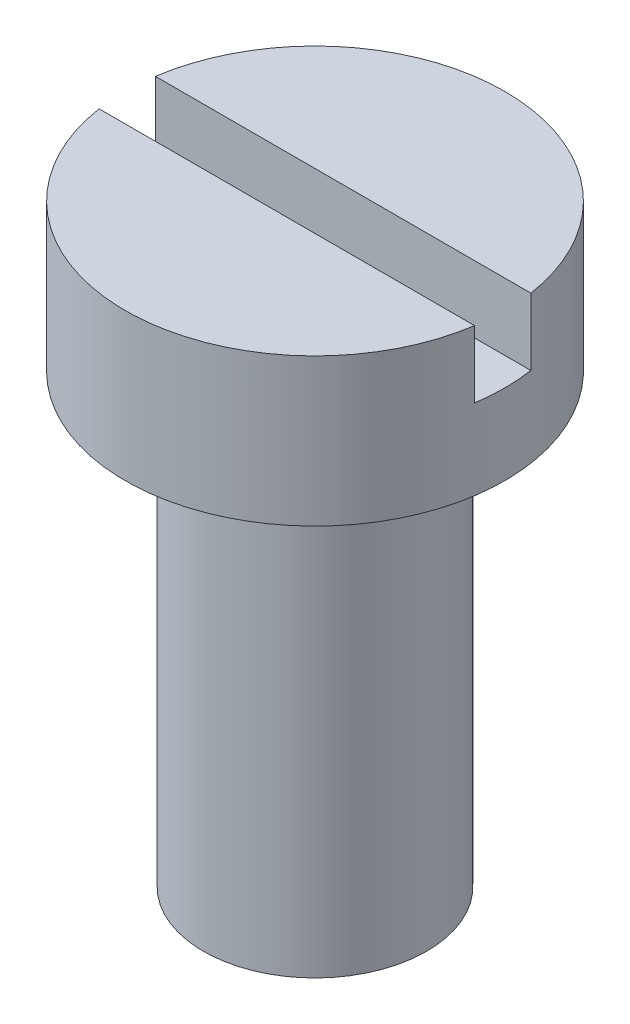
from build123d import *

# Parameters (mm, degrees)
CUT_EXTRUDE_1_DEPTH = 1.5


with BuildPart() as part:
    # Эскиз1 → Revolve 256 (revolve)
    with BuildSketch(Plane.XY, mode=Mode.PRIVATE) as revolve_256_sk:
        Polygon((0, 0), (2.5, 0), (2.5, 10), (4.25, 10), (4.25, 13.3), (0, 13.3), align=None)
    revolve(revolve_256_sk.sketch.rotate(Axis((0, 0, 0), (0, 1, 0)), 90), axis=Axis((0, 0, 0), (0, 1, 0)))

    # Эскиз2 → Вырез-Вытянуть1 (cut)
    with BuildSketch(Plane(origin=(0, 13.3, 0), x_dir=(-1, 0, 0), z_dir=(0, 1, 0))):
        with BuildLine():
            Line((-4.203046514, -0.63), (4.203046514, -0.63))
            ThreePointArc((4.203046514, -0.63), (4.25, 0), (4.203046514, 0.63))
            Line((4.203046514, 0.63), (-4.203046514, 0.63))
            ThreePointArc((-4.203046514, 0.63), (-4.25, 0), (-4.203046514, -0.63))
        make_face()
    extrude(amount=-CUT_EXTRUDE_1_DEPTH, mode=Mode.SUBTRACT)


solid = part.part
